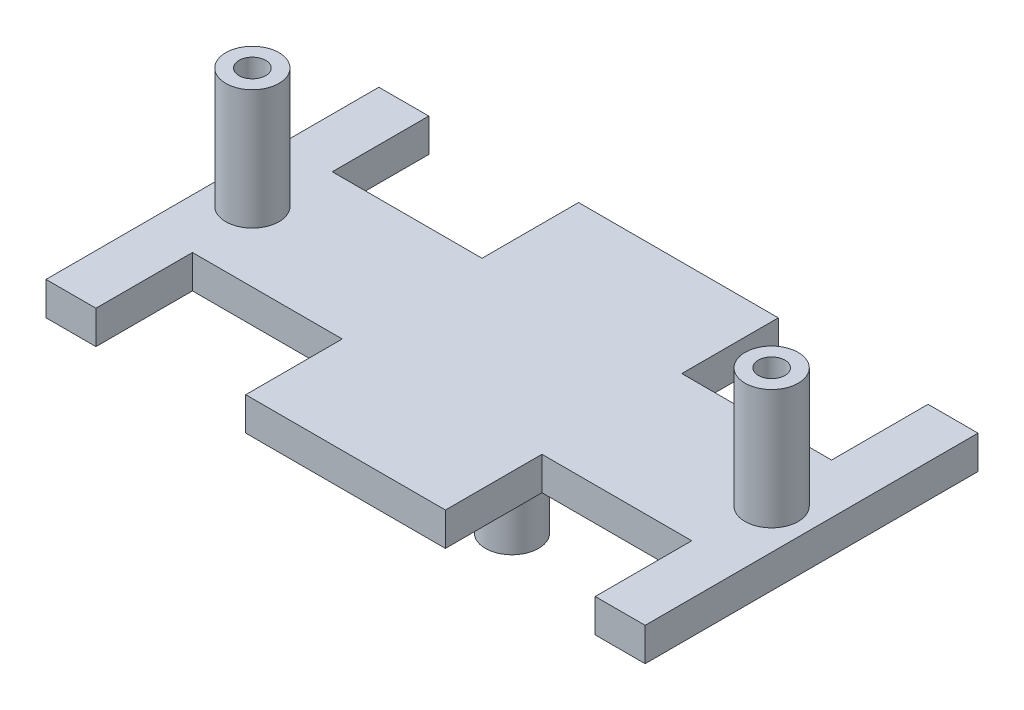
from build123d import *

# Parameters (mm, degrees)
SKETCH3_W            = 90
SKETCH3_H            = 50
BOSS_EXTRUDE1_DEPTH  = 5
CUT_EXTRUDE1_DEPTH   = 5
MIRROR2_COPY_1_DEPTH = 5
SKETCH5_R            = 4
BOSS_EXTRUDE2_DEPTH  = 18
SKETCH6_R            = 2
CUT_EXTRUDE2_DEPTH   = 18
SKETCH8_R            = 4
BOSS_EXTRUDE3_DEPTH  = 18
SKETCH9_R            = 2
CUT_EXTRUDE3_DEPTH   = 18


with BuildPart() as part:
    # Sketch3 → Boss-Extrude1 (new body)
    with BuildSketch(Plane(origin=(0, 0, 0), x_dir=(1, 0, 0), z_dir=(0, 1, 0))):
        with Locations((-74.593596059, 13.903940887)):
            Rectangle(SKETCH3_W, SKETCH3_H)
    extrude(amount=BOSS_EXTRUDE1_DEPTH)

    # Sketch4 → Cut-Extrude1 (cut)
    with BuildSketch(Plane(origin=(0, 5, 0), x_dir=(1, 0, 0), z_dir=(0, 1, 0))):
        Polygon((-90.093596059, 24.403940887), (-89.593596059, 24.403940887), (-89.593596059, 38.903940887), (-112.093596059, 38.903940887), (-112.093596059, 24.403940887), align=None)
    cut_extrude1 = extrude(amount=-CUT_EXTRUDE1_DEPTH, mode=Mode.SUBTRACT)

    # Mirror1: Cut-Extrude1 across plane
    add(cut_extrude1.mirror(Plane.XY.offset(-13.903940887)), mode=Mode.SUBTRACT)

    # Mirror2: Cut-Extrude1 across plane
    add(cut_extrude1.mirror(Plane.ZY.offset(74.593596059)), mode=Mode.SUBTRACT)

    # Mirror2 copy 1 sketch → Mirror2 copy 1 (cut)
    with BuildSketch(Plane(origin=(-149.187192118, 5, -27.807881773), x_dir=(-1, 0, 0), z_dir=(0, 1, 0))):
        Polygon((-90.093596059, 24.403940887), (-89.593596059, 24.403940887), (-89.593596059, 38.903940887), (-112.093596059, 38.903940887), (-112.093596059, 24.403940887), align=None)
    extrude(amount=-MIRROR2_COPY_1_DEPTH, mode=Mode.SUBTRACT)

    # Sketch5 → Boss-Extrude2 (add)
    with BuildSketch(Plane(origin=(0, 5, 0), x_dir=(1, 0, 0), z_dir=(0, 1, 0))):
        with Locations(Location((-35.593596059, 13.903940887, 0), (0, 0, 270))):
            Circle(SKETCH5_R)
    boss_extrude2 = extrude(amount=BOSS_EXTRUDE2_DEPTH)

    # Sketch6 → Cut-Extrude2 (cut)
    with BuildSketch(Plane(origin=(0, 23, 0), x_dir=(1, 0, 0), z_dir=(0, 1, 0))):
        with Locations(Location((-35.593596059, 13.903940887, 0), (0, 0, 270))):
            Circle(SKETCH6_R)
    cut_extrude2 = extrude(amount=-CUT_EXTRUDE2_DEPTH, mode=Mode.SUBTRACT)

    # Mirror4: Boss-Extrude2, Cut-Extrude2 across plane
    add(boss_extrude2.mirror(Plane.ZY.offset(74.593596059)))
    add(cut_extrude2.mirror(Plane.ZY.offset(74.593596059)), mode=Mode.SUBTRACT)

    # Sketch8 → Boss-Extrude3 (add)
    with BuildSketch(Plane(origin=(0, 0, 0), x_dir=(-1, 0, 0), z_dir=(0, -1, 0))):
        with Locations(Location((74.593596059, 13.903940887, 0), (0, 0, 270))):
            Circle(SKETCH8_R)
    extrude(amount=BOSS_EXTRUDE3_DEPTH)

    # Sketch9 → Cut-Extrude3 (cut)
    with BuildSketch(Plane(origin=(0, -18, 0), x_dir=(-1, 0, 0), z_dir=(0, -1, 0))):
        with Locations(Location((74.593596059, 13.903940887, 0), (0, 0, 90))):
            Circle(SKETCH9_R)
    extrude(amount=-CUT_EXTRUDE3_DEPTH, mode=Mode.SUBTRACT)


solid = part.part
